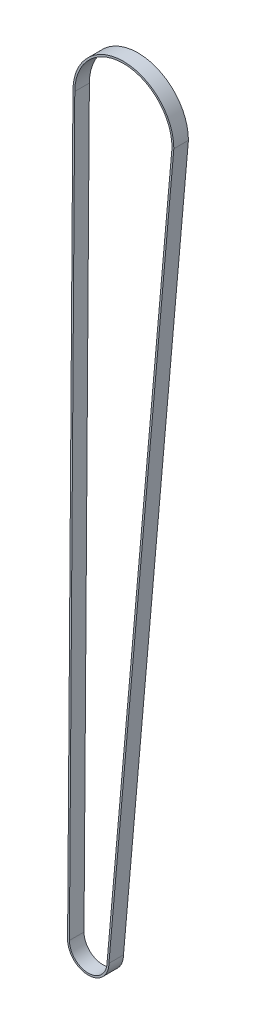
from build123d import *

# Parameters (mm, degrees)
BOSS_EXTRUDE1_DEPTH = 6


with BuildPart() as part:
    # Sketch2 → Boss-Extrude1 (new body)
    with BuildSketch(Plane.XY):
        with BuildLine():
            Line((-9.993323568, 157.603469114), (-12.203121146, -146.002354665))
            ThreePointArc((-12.203121146, -146.002354665), (-3.721360774, -154.50512752), (4.796811646, -146.038832945))
            Line((4.796811646, -146.038832945), (31.506649641, 157.567485023))
            ThreePointArc((31.506649641, 157.567485023), (10.774668299, 178.35070679), (-9.993323568, 157.603469114))
        make_face()
        with BuildLine():
            Line((-9.243323751, 157.600714591), (-11.453121604, -146.005147089))
            ThreePointArc((-11.453121604, -146.005147089), (-3.703121604, -153.755147089), (4.046878396, -146.005147089))
            Line((4.046878396, -146.005147089), (30.756676249, 157.600714591))
            ThreePointArc((30.756676249, 157.600714591), (10.756676249, 177.600714591), (-9.243323751, 157.600714591))
        make_face(mode=Mode.SUBTRACT)
    extrude(amount=BOSS_EXTRUDE1_DEPTH)


solid = part.part
